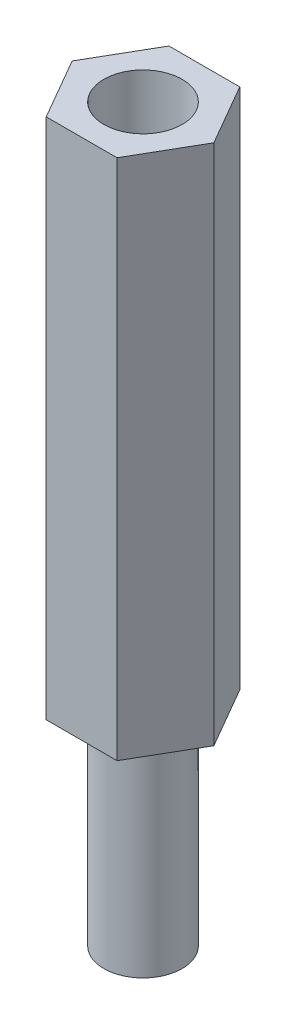
from build123d import *

# Parameters (mm, degrees)
SKETCH_1_R      = 1.5
EXTRUDE_1_DEPTH = 20
SKETCH_2_R      = 1.5
EXTRUDE_2_DEPTH = 8


with BuildPart() as part:
    # 草图1 → 凸台-拉伸1 (new body)
    with BuildSketch(Plane(origin=(0, 0, 0), x_dir=(1, 0, 0), z_dir=(0, 1, 0))):
        Polygon((2.713546265, 0), (1.356773133, 2.35), (-1.356773133, 2.35), (-2.713546265, 0), (-1.356773133, -2.35), (1.356773133, -2.35), align=None)
        with Locations(Location((0, 0, 0), (0, 0, 270))):
            Circle(SKETCH_1_R, mode=Mode.SUBTRACT)
    extrude(amount=EXTRUDE_1_DEPTH)


with BuildPart() as body_2:
    # 草图2 → 凸台-拉伸2 (new body)
    with BuildSketch(Plane(origin=(0, 0, 0), x_dir=(-1, 0, 0), z_dir=(0, -1, 0))):
        with Locations(Location((0, 0, 0), (0, 0, 90))):
            Circle(SKETCH_2_R)
    extrude(amount=EXTRUDE_2_DEPTH)


solid = Compound([part.part, body_2.part])
